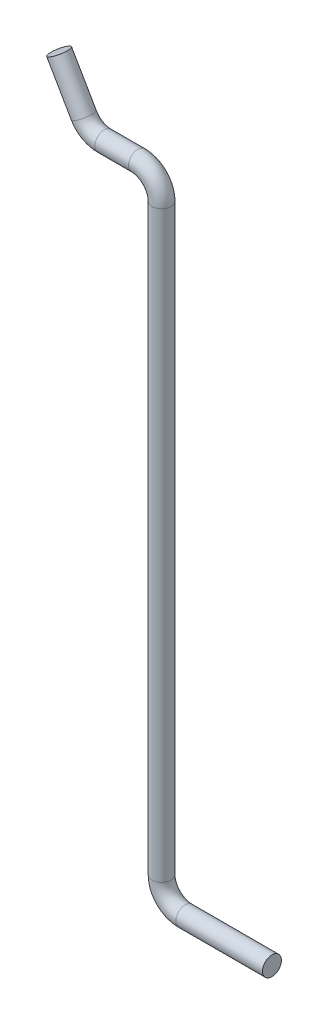
from build123d import *

# Parameters (mm, degrees)
SWEEP_1_PROFILE_R = 0.6


with BuildPart() as part:
    # 扫描1: sweep along a path in 草图1
    with BuildLine(Plane.XY) as sweep_1_path:
        Line((-2, 3.464101615), (-0.433012702, 0.75))
        ThreePointArc((-0.433012702, 0.75), (0.116025404, 0.200961894), (0.866025404, 0))
        Line((0.866025404, 0), (3, 0))
        ThreePointArc((3, 0), (4.060660172, -0.439339828), (4.5, -1.5))
        Line((4.5, -1.5), (4.5, -38.5))
        ThreePointArc((4.5, -38.5), (4.939339828, -39.560660172), (6, -40))
        Line((6, -40), (11.5, -40))
    # 扫描1 profile (on start of the path) → 扫描1 (sweep)
    with BuildSketch(Plane(origin=(-2, 3.464101615, 0), x_dir=(-0.8660254037844379, -0.5000000000000013, 0), z_dir=(0.5000000000000013, -0.8660254037844379, 0))):
        Circle(SWEEP_1_PROFILE_R)
    sweep(path=sweep_1_path.line)


solid = part.part
